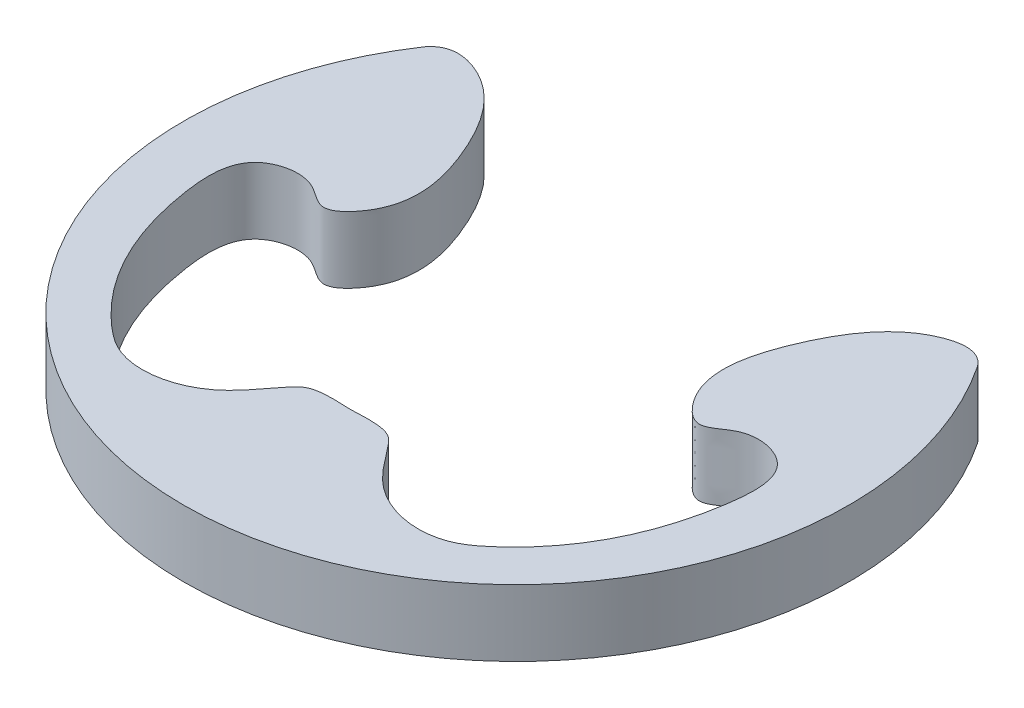
from build123d import *

# Parameters (mm, degrees)
SKETCH1_R           = 2
BOSS_EXTRUDE1_DEPTH = 0.4
CUT_EXTRUDE1_REACH  = 4.857


with BuildPart() as part:
    # Sketch1 → Boss-Extrude1 (new body)
    with BuildSketch(Plane(origin=(0, 0, 0), x_dir=(1, 0, 0), z_dir=(0, 1, 0))):
        with Locations(Location((0, 0, 0), (0, 0, 270))):
            Circle(SKETCH1_R)
    extrude(amount=BOSS_EXTRUDE1_DEPTH)

    # Sketch2 → Cut-Extrude1 (cut, up to next)
    with BuildSketch(Plane(origin=(0, 0.4, 0), x_dir=(1, 0, 0), z_dir=(0, 1, 0)), mode=Mode.PRIVATE) as cut_extrude1_sk1:
        with BuildLine():
            ThreePointArc((0.079180834, -0.996860269), (0.734568184, -0.67853488), (1, 0))
            ThreePointArc((1, 0), (0.999439949, 0.033463225), (0.997760425, 0.066888967))
            add(Edge.make_bspline(
                [(0.997760425, 0.066888967), (0.923840356, 0.167723917), (0.905669567, 0.280606333), (0.91845053, 0.395535869)],
                knots=[0.684138156, 0.684138156, 0.684138156, 0.684138156, 0.753012483, 0.753012483, 0.753012483, 0.753012483], degree=3))
            ThreePointArc((0.91845053, 0.395535869), (0, 1), (-0.91845053, 0.395535869))
            add(Edge.make_bspline(
                [(-0.997760425, 0.066888967), (-0.923840356, 0.167723917), (-0.905669567, 0.280606333), (-0.91845053, 0.395535869)],
                knots=[0.684138156, 0.684138156, 0.684138156, 0.684138156, 0.753012483, 0.753012483, 0.753012483, 0.753012483], degree=3))
            ThreePointArc((-0.997760425, 0.066888967), (-0.756862754, -0.653573846), (-0.079180834, -0.996860269))
            add(Edge.make_bspline(
                [(0, -1), (-0.029644718, -0.998325418), (-0.055864408, -0.99726828), (-0.079180834, -0.996860269)],
                knots=[0, 0, 0, 0, 0.008951837, 0.008951837, 0.008951837, 0.008951837], degree=3))
            add(Edge.make_bspline(
                [(0, -1), (0.029644718, -0.998325418), (0.055864408, -0.99726828), (0.079180834, -0.996860269)],
                knots=[0, 0, 0, 0, 0.008951837, 0.008951837, 0.008951837, 0.008951837], degree=3))
        make_face()
    cut_extrude1_tool1 = extrude(cut_extrude1_sk1.sketch, amount=-CUT_EXTRUDE1_REACH, mode=Mode.PRIVATE) & part.part
    # Sketch2 → Cut-Extrude1 (cut, up to next)
    with BuildSketch(Plane(origin=(0, 0.4, 0), x_dir=(1, 0, 0), z_dir=(0, 1, 0)), mode=Mode.PRIVATE) as cut_extrude1_sk2:
        with BuildLine():
            ThreePointArc((0.997760425, 0.066888967), (0.999439949, 0.033463225), (1, 0))
            ThreePointArc((1, 0), (0.734568184, -0.67853488), (0.079180834, -0.996860269))
            add(Edge.make_bspline(
                [(0.079180834, -0.996860269), (0.219659795, -0.994402048), (0.294604839, -1.039474199), (0.516134817, -1.395034291), (0.919266366, -1.467116927), (1.383294213, -1.105481229), (1.623532565, -0.635686702), (1.660887272, 0.031021168), (1.305653816, 0.110584823), (1.133558189, -0.076221339), (1.03324066, 0.018490098), (0.997760425, 0.066888967)],
                knots=[0.008951837, 0.008951837, 0.008951837, 0.008951837, 0.062885693, 0.124135561, 0.231355194, 0.267285206, 0.479704212, 0.555549734, 0.615510884, 0.651079781, 0.684138156, 0.684138156, 0.684138156, 0.684138156], degree=3))
        make_face()
    cut_extrude1_tool2 = extrude(cut_extrude1_sk2.sketch, amount=-CUT_EXTRUDE1_REACH, mode=Mode.PRIVATE) & part.part
    # Sketch2 → Cut-Extrude1 (cut, up to next)
    with BuildSketch(Plane(origin=(0, 0.4, 0), x_dir=(1, 0, 0), z_dir=(0, 1, 0)), mode=Mode.PRIVATE) as cut_extrude1_sk3:
        with BuildLine():
            ThreePointArc((-0.91845053, 0.395535869), (0, 1), (0.91845053, 0.395535869))
            add(Edge.make_bspline(
                [(0.91845053, 0.395535869), (0.929052918, 0.490875126), (1.032093916, 0.80336661), (1.265336351, 1.154910658), (1.596101316, 1.200023422), (1.663870633, 1.109745249)],
                knots=[0.753012483, 0.753012483, 0.753012483, 0.753012483, 0.810146857, 0.937553871, 0.995414322, 0.995414322, 0.995414322, 0.995414322], degree=3))
            ThreePointArc((1.663870633, 1.109745249), (0, 2), (-1.663870633, 1.109745249))
            add(Edge.make_bspline(
                [(-0.91845053, 0.395535869), (-0.929052918, 0.490875126), (-1.032093916, 0.80336661), (-1.265336351, 1.154910658), (-1.596101316, 1.200023422), (-1.663870633, 1.109745249)],
                knots=[0.753012483, 0.753012483, 0.753012483, 0.753012483, 0.810146857, 0.937553871, 0.995414322, 0.995414322, 0.995414322, 0.995414322], degree=3))
        make_face()
    cut_extrude1_tool3 = extrude(cut_extrude1_sk3.sketch, amount=-CUT_EXTRUDE1_REACH, mode=Mode.PRIVATE) & part.part
    # Sketch2 → Cut-Extrude1 (cut, up to next)
    with BuildSketch(Plane(origin=(0, 0.4, 0), x_dir=(1, 0, 0), z_dir=(0, 1, 0)), mode=Mode.PRIVATE) as cut_extrude1_sk4:
        with BuildLine():
            add(Edge.make_bspline(
                [(-0.079180834, -0.996860269), (-0.219659795, -0.994402048), (-0.294604839, -1.039474199), (-0.516134817, -1.395034291), (-0.919266366, -1.467116927), (-1.383294213, -1.105481229), (-1.623532565, -0.635686702), (-1.660887272, 0.031021168), (-1.305653816, 0.110584823), (-1.133558189, -0.076221339), (-1.03324066, 0.018490098), (-0.997760425, 0.066888967)],
                knots=[0.008951837, 0.008951837, 0.008951837, 0.008951837, 0.062885693, 0.124135561, 0.231355194, 0.267285206, 0.479704212, 0.555549734, 0.615510884, 0.651079781, 0.684138156, 0.684138156, 0.684138156, 0.684138156], degree=3))
            ThreePointArc((-0.079180834, -0.996860269), (-0.756862754, -0.653573846), (-0.997760425, 0.066888967))
        make_face()
    cut_extrude1_tool4 = extrude(cut_extrude1_sk4.sketch, amount=-CUT_EXTRUDE1_REACH, mode=Mode.PRIVATE) & part.part
    add(cut_extrude1_tool1.solids().sort_by_distance((0, 0.4, 0.001518))[0], mode=Mode.SUBTRACT)
    add(cut_extrude1_tool2.solids().sort_by_distance((1.056981, 0.4, 0.721965))[0], mode=Mode.SUBTRACT)
    add(cut_extrude1_tool3.solids().sort_by_distance((0, 0.4, -1.334977))[0], mode=Mode.SUBTRACT)
    add(cut_extrude1_tool4.solids().sort_by_distance((-1.056981, 0.4, 0.721965))[0], mode=Mode.SUBTRACT)


solid = part.part
